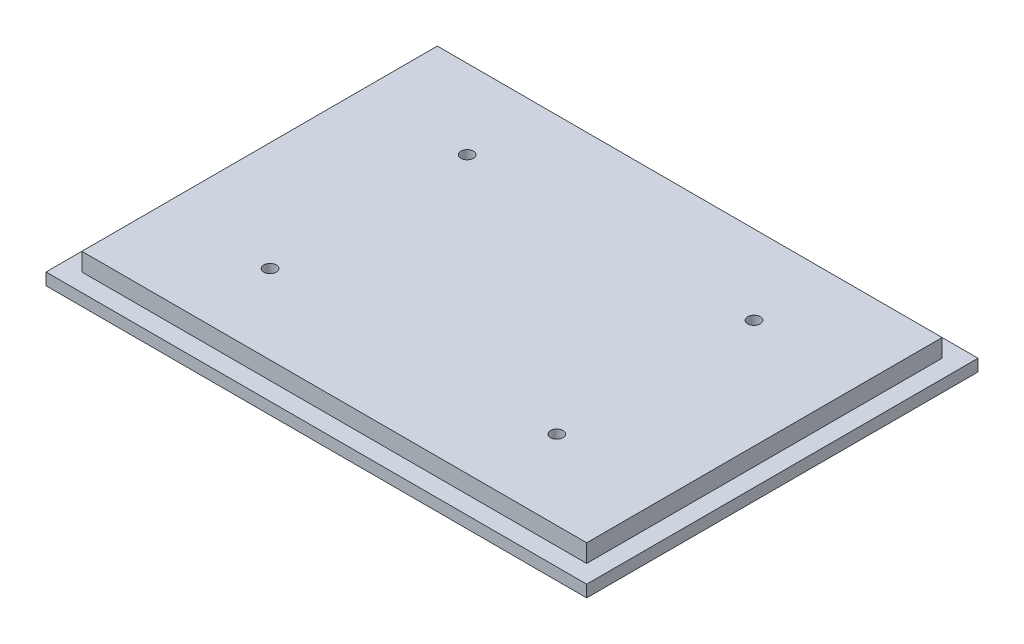
from build123d import *

# Parameters (mm, degrees)
ESQUISSE1_W             = 169
ESQUISSE1_H             = 119
BOSS_EXTRU_1_DEPTH      = 10
ESQUISSE2_W             = 181
ESQUISSE2_H             = 131
BOSS_EXTRU_2_DEPTH      = 4
ESQUISSE3_R             = 2.1
ENL_V_MAT_EXTRU_1_DEPTH = 113.162828067


with BuildPart() as part:
    # Esquisse1 → Boss.-Extru.1 (new body)
    with BuildSketch(Plane(origin=(0, 0, 0), x_dir=(1, 0, 0), z_dir=(0, 1, 0))):
        Rectangle(ESQUISSE1_W, ESQUISSE1_H)
    extrude(amount=BOSS_EXTRU_1_DEPTH)

    # Esquisse2 → Boss.-Extru.2 (add)
    with BuildSketch(Plane(origin=(0, 0, 0), x_dir=(1, 0, 0), z_dir=(0, 1, 0))):
        Rectangle(ESQUISSE2_W, ESQUISSE2_H)
    extrude(amount=BOSS_EXTRU_2_DEPTH)

    # Esquisse3 → Enlèv. mat.-Extru.1 (cut, through all)
    with BuildSketch(Plane(origin=(0, 10, 0), x_dir=(1, 0, 0), z_dir=(0, 1, 0))):
        with Locations(Location((-48, 33, 0), (0, 0, 270))):
            Circle(ESQUISSE3_R)
        with Locations(Location((48, 33, 0), (0, 0, 270))):
            Circle(ESQUISSE3_R)
        with Locations(Location((48, -33, 0), (0, 0, 270))):
            Circle(ESQUISSE3_R)
        with Locations(Location((-48, -33, 0), (0, 0, 270))):
            Circle(ESQUISSE3_R)
    extrude(amount=-ENL_V_MAT_EXTRU_1_DEPTH, mode=Mode.SUBTRACT)


solid = part.part
